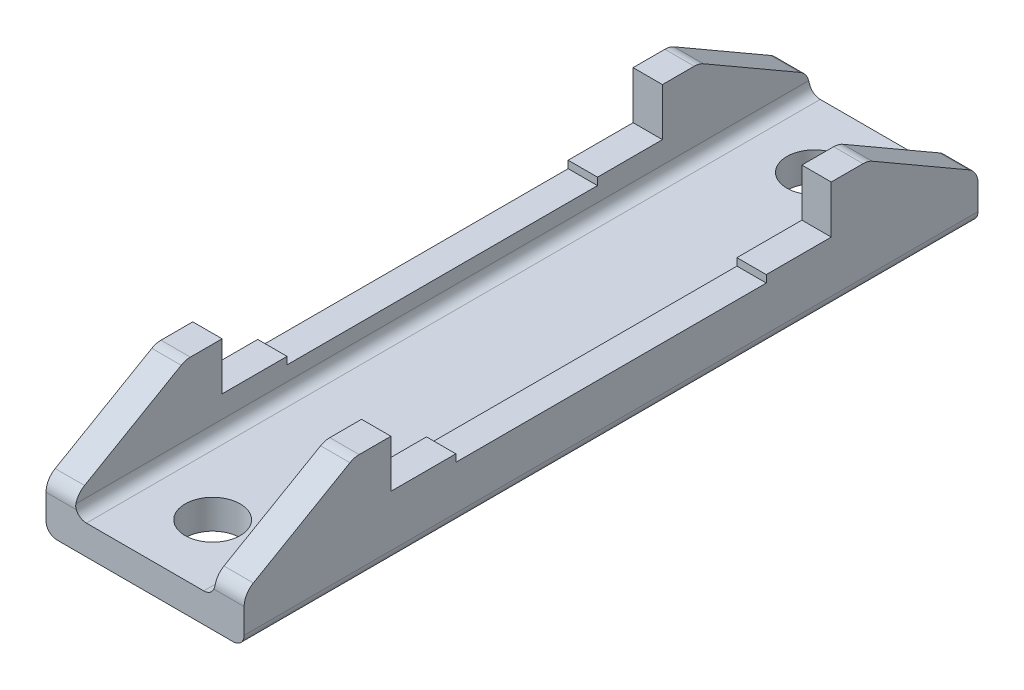
from build123d import *

# Parameters (mm, degrees)
DODANIE_WYCI_GNI_CIE1_DEPTH = 8
DODANIE_WYCI_GNI_CIE2_REACH = 171.163
SZKIC2_W                    = 200
SZKIC2_H                    = 8
ZAOKR_GLENIE1_R             = 3
ZAOKR_GLENIE2_R             = 3
SZKIC3_R                    = 7.5
WYTNIJ_WYCI_GNI_CIE1_DEPTH  = 170.162643752


with BuildPart() as part:
    # Szkic1 → Dodanie-wyciągnięcie1 (new body)
    with BuildSketch(Plane(origin=(0, 0, 0), x_dir=(0, 0, -1), z_dir=(1, 0, 0))):
        with BuildLine():
            Line((0, 0), (-8.660254038, 0))
            ThreePointArc((-8.660254038, 0), (-9.954349263, -0.170370869), (-11.160254038, -0.669872981))
            Line((-11.160254038, -0.669872981), (-37.5, -15.877132403))
            ThreePointArc((-37.5, -15.877132403), (-39.330127019, -17.707259422), (-40, -20.207259422))
            Line((-40, -20.207259422), (-40, -30))
            Line((-40, -30), (160, -30))
            Line((160, -30), (160, -20.207259422))
            ThreePointArc((160, -20.207259422), (159.330127019, -17.707259422), (157.5, -15.877132403))
            Line((157.5, -15.877132403), (131.160254038, -0.669872981))
            ThreePointArc((131.160254038, -0.669872981), (129.954349263, -0.170370869), (128.660254038, 0))
            Line((128.660254038, 0), (120, 0))
            Line((120, 0), (120, -13))
            Line((120, -13), (102.3, -13))
            Line((102.3, -13), (102.3, -15))
            Line((102.3, -15), (17.7, -15))
            Line((17.7, -15), (17.7, -13))
            Line((17.7, -13), (0, -13))
            Line((0, -13), (0, 0))
        make_face()
    extrude(amount=DODANIE_WYCI_GNI_CIE1_DEPTH)


with BuildPart() as body_2:
    # Lustro3: mirrored copy
    add(part.part.mirror(Plane.ZY.offset(19)))

    # Szkic2 → Dodanie-wyciągnięcie2 (add, up to next)
    with BuildSketch(Plane.ZY, mode=Mode.PRIVATE) as dodanie_wyci_gni_cie2_sk1:
        with Locations((-60, -26)):
            Rectangle(SZKIC2_W, SZKIC2_H)
    dodanie_wyci_gni_cie2_tool1 = extrude(dodanie_wyci_gni_cie2_sk1.sketch, amount=DODANIE_WYCI_GNI_CIE2_REACH, mode=Mode.PRIVATE) - body_2.part

    add(part.part)  # Dodanie-wyciągnięcie2 merges part
    add(dodanie_wyci_gni_cie2_tool1.solids().sort_by_distance((0, -26, -60))[0])

    # Zaokrąglenie1
    zaokr_glenie1_edges = [body_2.edges().sort_by_distance(p)[0] for p in [
        (8, -30, -60),
        (-46, -30, -60),
    ]]
    fillet(zaokr_glenie1_edges, radius=ZAOKR_GLENIE1_R)

    # Zaokrąglenie2
    zaokr_glenie2_edges = [body_2.edges().sort_by_distance(p)[0] for p in [
        (0, -22, -60),
        (-38, -22, -60),
    ]]
    fillet(zaokr_glenie2_edges, radius=ZAOKR_GLENIE2_R)

    # Szkic3 → Wytnij-wyciągnięcie1 (cut, through all)
    with BuildSketch(Plane.XZ.offset(30)):
        with Locations(Location((-18.58033314, 22, 0), (0, 0, 270))):
            Circle(SZKIC3_R)
        with Locations(Location((-18.58033314, -142, 0), (0, 0, 270))):
            Circle(SZKIC3_R)
    extrude(amount=-WYTNIJ_WYCI_GNI_CIE1_DEPTH, mode=Mode.SUBTRACT)


solid = body_2.part
